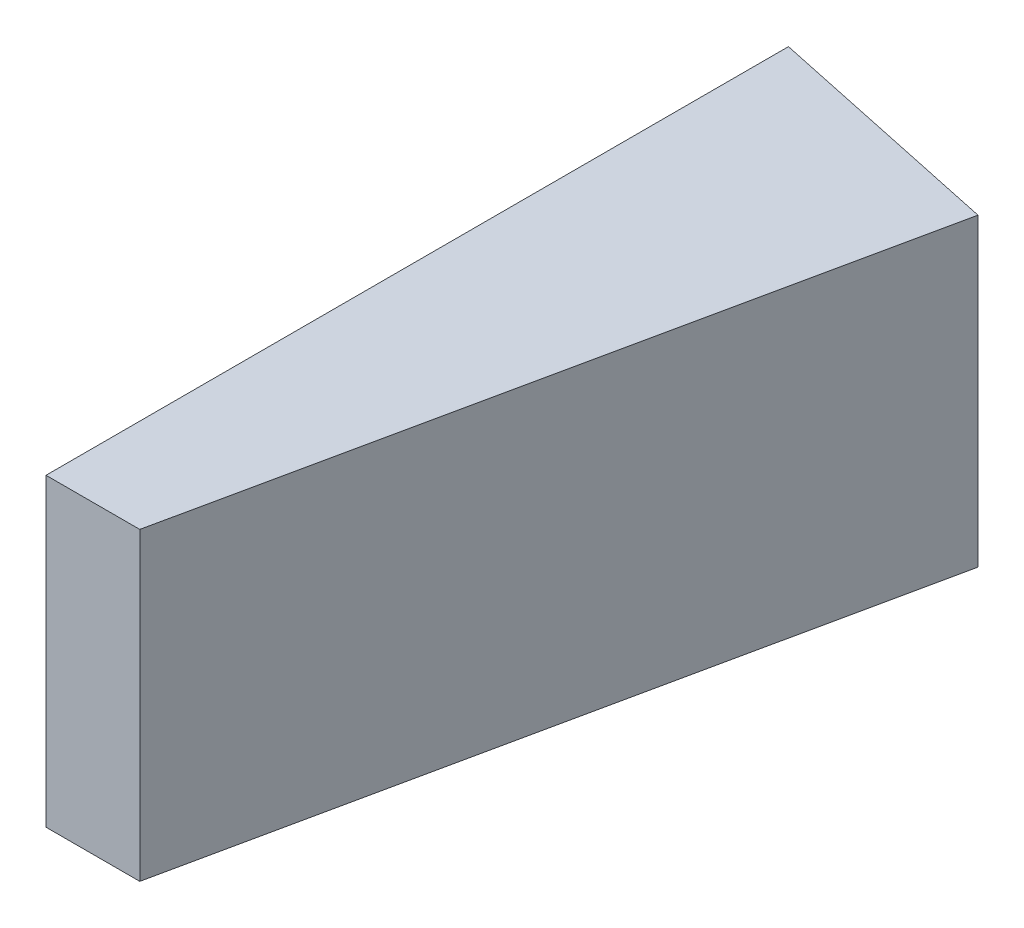
from build123d import *

# Parameters (mm, degrees)
BOSS_EXTRUDE1_DEPTH = 10


with BuildPart() as part:
    # Sketch1 → Boss-Extrude1 (new body)
    with BuildSketch(Plane(origin=(0, 0, 0), x_dir=(1, 0, 0), z_dir=(0, 1, 0))):
        Polygon((0, 0), (0, 24.357740191), (7.897691353, 22.679034072), (3.077113849, 0), align=None)
    extrude(amount=BOSS_EXTRUDE1_DEPTH)


solid = part.part
